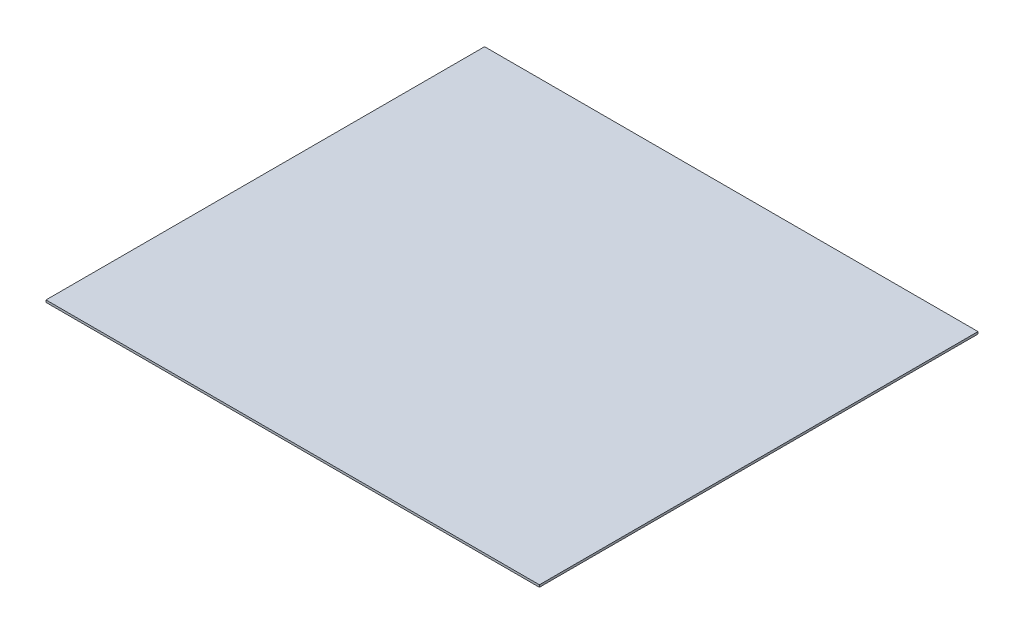
from build123d import *

# Parameters (mm, degrees)
SKETCH1_W           = 450
SKETCH1_H           = 400
BOSS_EXTRUDE1_DEPTH = 2


with BuildPart() as part:
    # Sketch1 → Boss-Extrude1 (new body)
    with BuildSketch(Plane(origin=(0, -50.000000076, 0), x_dir=(1, 0, 0), z_dir=(0, 1, 0))):
        Rectangle(SKETCH1_W, SKETCH1_H)
    extrude(amount=BOSS_EXTRUDE1_DEPTH)


solid = part.part
